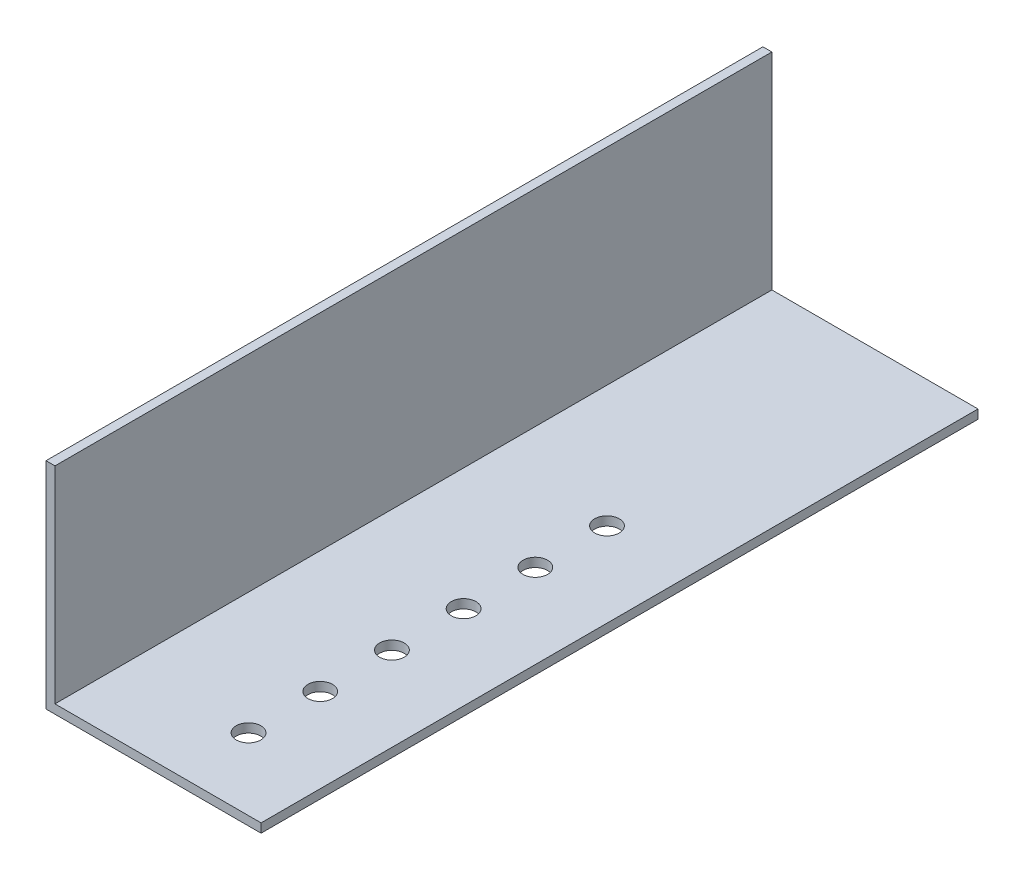
from build123d import *

# Parameters (mm, degrees)
BOSS_EXTRUDE1_DEPTH = 127
SKETCH2_R           = 2.1828125
CUT_EXTRUDE1_DEPTH  = 127


with BuildPart() as part:
    # Sketch1 → Boss-Extrude1 (new body)
    with BuildSketch(Plane.XY):
        Polygon((0, 0), (0, 38.1), (1.5875, 38.1), (1.5875, 1.5875), (38.1, 1.5875), (38.1, 0), align=None)
    extrude(amount=BOSS_EXTRUDE1_DEPTH)

    # Sketch2 → Cut-Extrude1 (cut)
    with BuildSketch(Plane(origin=(0, 1.5875, 0), x_dir=(1, 0, 0), z_dir=(0, 1, 0))):
        with Locations(Location((23.1775, -114.3, 0), (0, 0, 180))):
            Circle(SKETCH2_R)
        with Locations(Location((23.1775, -101.6, 0), (0, 0, 180))):
            Circle(SKETCH2_R)
        with Locations(Location((23.1775, -88.9, 0), (0, 0, 180))):
            Circle(SKETCH2_R)
        with Locations(Location((23.1775, -76.2, 0), (0, 0, 180))):
            Circle(SKETCH2_R)
        with Locations(Location((23.1775, -63.5, 0), (0, 0, 180))):
            Circle(SKETCH2_R)
        with Locations(Location((23.1775, -50.8, 0), (0, 0, 180))):
            Circle(SKETCH2_R)
    extrude(amount=-CUT_EXTRUDE1_DEPTH, mode=Mode.SUBTRACT)


solid = part.part
